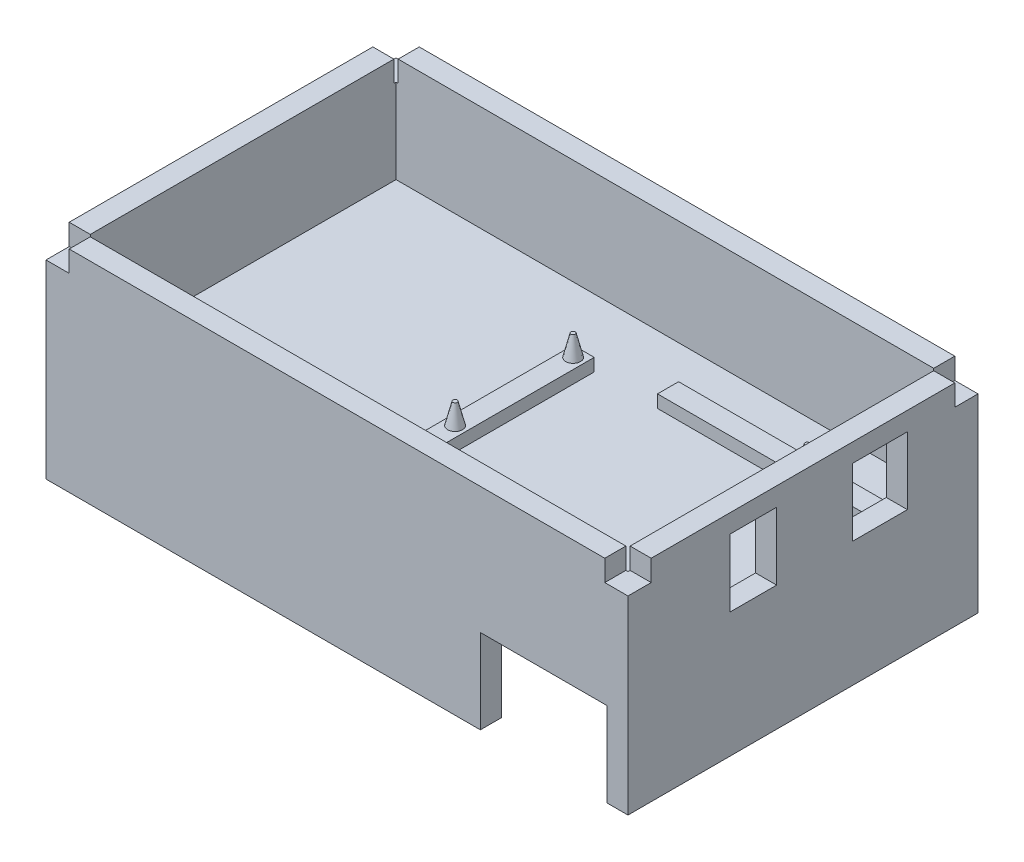
from build123d import *

# Parameters (mm, degrees)
SKETCH1_W                      = 138
SKETCH1_H                      = 83
BOSS_EXTRUDE1_DEPTH            = 5
SKETCH2_W                      = 138
SKETCH2_H                      = 83
SKETCH2_W_2                    = 128
SKETCH2_H_2                    = 73
BOSS_EXTRUDE2_DEPTH            = 20
CUT_EXTRUDE1_REACH             = 108.042
SKETCH3_W                      = 30
SKETCH3_H                      = 20
SKETCH4_W                      = 138
SKETCH4_H                      = 83
SKETCH4_W_2                    = 128
SKETCH4_H_2                    = 73
BOSS_EXTRUDE3_DEPTH            = 25
SKETCH5_W                      = 50
SKETCH5_H                      = 5
SKETCH5_W_2                    = 5
SKETCH5_H_2                    = 35
BOSS_EXTRUDE10_DEPTH           = 3
SKETCH6_R                      = 1.75
BOSS_EXTRUDE11_DEPTH           = 5
BOSS_EXTRUDE11_DRAFT           = 14
BOSS_EXTRUDE11_PROFILE_2_DEPTH = 5
BOSS_EXTRUDE11_PROFILE_2_DRAFT = 14
BOSS_EXTRUDE11_PROFILE_3_DEPTH = 5
BOSS_EXTRUDE11_PROFILE_3_DRAFT = 14
BOSS_EXTRUDE11_PROFILE_4_DEPTH = 5
BOSS_EXTRUDE11_PROFILE_4_DRAFT = 14
CUT_EXTRUDE2_REACH             = 144.518
SKETCH7_W                      = 13
SKETCH7_H                      = 16
CUT_EXTRUDE3_REACH             = 144.518
SKETCH8_W                      = 11
SKETCH8_H                      = 16
SKETCH11_W                     = 5.5
SKETCH11_H                     = 5.5
CUT_EXTRUDE7_DEPTH             = 5


with BuildPart() as part:
    # Sketch1 → Boss-Extrude1 (new body)
    with BuildSketch(Plane(origin=(0, 0, 0), x_dir=(1, 0, 0), z_dir=(0, 1, 0))):
        Rectangle(SKETCH1_W, SKETCH1_H)
    extrude(amount=BOSS_EXTRUDE1_DEPTH)

    # Sketch2 → Boss-Extrude2 (add)
    with BuildSketch(Plane.XZ):
        Rectangle(SKETCH2_W, SKETCH2_H)
        Rectangle(SKETCH2_W_2, SKETCH2_H_2, mode=Mode.SUBTRACT)
    extrude(amount=BOSS_EXTRUDE2_DEPTH)

    # Sketch3 → Cut-Extrude1 (cut, up to next)
    with BuildSketch(Plane(origin=(0, 0, 36.5), x_dir=(-1, 0, 0), z_dir=(0, 0, -1)), mode=Mode.PRIVATE) as cut_extrude1_sk1:
        with Locations((-49, -10)):
            Rectangle(SKETCH3_W, SKETCH3_H)
    cut_extrude1_tool1 = extrude(cut_extrude1_sk1.sketch, amount=-CUT_EXTRUDE1_REACH, mode=Mode.PRIVATE) & part.part
    add(cut_extrude1_tool1.solids().sort_by_distance((49, -10, 36.5))[0], mode=Mode.SUBTRACT)

    # Sketch4 → Boss-Extrude3 (add)
    with BuildSketch(Plane(origin=(0, 5, 0), x_dir=(1, 0, 0), z_dir=(0, 1, 0))):
        Rectangle(SKETCH4_W, SKETCH4_H)
        Rectangle(SKETCH4_W_2, SKETCH4_H_2, mode=Mode.SUBTRACT)
    extrude(amount=BOSS_EXTRUDE3_DEPTH)

    # Sketch5 → Boss-Extrude10 (add)
    with BuildSketch(Plane(origin=(0, 5, 0), x_dir=(1, 0, 0), z_dir=(0, 1, 0))):
        with Locations((39, -26)):
            Rectangle(SKETCH5_W, SKETCH5_H)
        with Locations((39, 23)):
            Rectangle(SKETCH5_W, SKETCH5_H)
        with Locations((-3.5, 3)):
            Rectangle(SKETCH5_W_2, SKETCH5_H_2)
    extrude(amount=BOSS_EXTRUDE10_DEPTH)


with BuildPart() as boss_extrude11_tool:
    # Sketch6 → Boss-Extrude11 (with draft: the straight prism first)
    with BuildSketch(Plane(origin=(0, 8, 0), x_dir=(1, 0, 0), z_dir=(0, 1, 0))):
        with Locations((47, 23)):
            Circle(SKETCH6_R)
    extrude(amount=BOSS_EXTRUDE11_DEPTH)
    # Boss-Extrude11: the draft: its side faces are tilted about the plane it starts from
    boss_extrude11_sides = [boss_extrude11_tool.faces().sort_by_distance(p)[0] for p in [
        (45.25, 10.5, -23),
    ]]
    draft(boss_extrude11_sides, Plane(origin=(0, 8, 0), x_dir=(1, 0, 0), z_dir=(0, 1, 0)), BOSS_EXTRUDE11_DRAFT)


with BuildPart() as part_1:
    add(part.part)

    # Boss-Extrude11: add boss_extrude11_tool
    add(boss_extrude11_tool.part)


with BuildPart() as boss_extrude11_profile_2_tool:
    # Sketch6 → Boss-Extrude11 profile 2 (with draft: the straight prism first)
    with BuildSketch(Plane(origin=(0, 8, 0), x_dir=(1, 0, 0), z_dir=(0, 1, 0))):
        with Locations((47, -26)):
            Circle(SKETCH6_R)
    extrude(amount=BOSS_EXTRUDE11_PROFILE_2_DEPTH)
    # Boss-Extrude11 profile 2: the draft: its side faces are tilted about the plane it starts from
    boss_extrude11_profile_2_sides = [boss_extrude11_profile_2_tool.faces().sort_by_distance(p)[0] for p in [
        (45.25, 10.5, 26),
    ]]
    draft(boss_extrude11_profile_2_sides, Plane(origin=(0, 8, 0), x_dir=(1, 0, 0), z_dir=(0, 1, 0)), BOSS_EXTRUDE11_PROFILE_2_DRAFT)


with BuildPart() as part_2:
    add(part_1.part)

    # Boss-Extrude11 profile 2: add boss_extrude11_profile_2_tool
    add(boss_extrude11_profile_2_tool.part)


with BuildPart() as boss_extrude11_profile_3_tool:
    # Sketch6 → Boss-Extrude11 profile 3 (with draft: the straight prism first)
    with BuildSketch(Plane(origin=(0, 8, 0), x_dir=(1, 0, 0), z_dir=(0, 1, 0))):
        with Locations((-3.5, 18)):
            Circle(SKETCH6_R)
    extrude(amount=BOSS_EXTRUDE11_PROFILE_3_DEPTH)
    # Boss-Extrude11 profile 3: the draft: its side faces are tilted about the plane it starts from
    boss_extrude11_profile_3_sides = [boss_extrude11_profile_3_tool.faces().sort_by_distance(p)[0] for p in [
        (-5.25, 10.5, -18),
    ]]
    draft(boss_extrude11_profile_3_sides, Plane(origin=(0, 8, 0), x_dir=(1, 0, 0), z_dir=(0, 1, 0)), BOSS_EXTRUDE11_PROFILE_3_DRAFT)


with BuildPart() as part_3:
    add(part_2.part)

    # Boss-Extrude11 profile 3: add boss_extrude11_profile_3_tool
    add(boss_extrude11_profile_3_tool.part)


with BuildPart() as boss_extrude11_profile_4_tool:
    # Sketch6 → Boss-Extrude11 profile 4 (with draft: the straight prism first)
    with BuildSketch(Plane(origin=(0, 8, 0), x_dir=(1, 0, 0), z_dir=(0, 1, 0))):
        with Locations((-3.5, -10)):
            Circle(SKETCH6_R)
    extrude(amount=BOSS_EXTRUDE11_PROFILE_4_DEPTH)
    # Boss-Extrude11 profile 4: the draft: its side faces are tilted about the plane it starts from
    boss_extrude11_profile_4_sides = [boss_extrude11_profile_4_tool.faces().sort_by_distance(p)[0] for p in [
        (-5.25, 10.5, 10),
    ]]
    draft(boss_extrude11_profile_4_sides, Plane(origin=(0, 8, 0), x_dir=(1, 0, 0), z_dir=(0, 1, 0)), BOSS_EXTRUDE11_PROFILE_4_DRAFT)


with BuildPart() as part_4:
    add(part_3.part)

    # Boss-Extrude11 profile 4: add boss_extrude11_profile_4_tool
    add(boss_extrude11_profile_4_tool.part)

    # Sketch7 → Cut-Extrude2 (cut, up to next)
    with BuildSketch(Plane.ZY.offset(-64), mode=Mode.PRIVATE) as cut_extrude2_sk1:
        with Locations((-18.25, 17.6)):
            Rectangle(SKETCH7_W, SKETCH7_H)
    cut_extrude2_tool1 = extrude(cut_extrude2_sk1.sketch, amount=-CUT_EXTRUDE2_REACH, mode=Mode.PRIVATE) & part_4.part
    add(cut_extrude2_tool1.solids().sort_by_distance((64, 17.6, -18.25))[0], mode=Mode.SUBTRACT)

    # Sketch8 → Cut-Extrude3 (cut, up to next)
    with BuildSketch(Plane.ZY.offset(-64), mode=Mode.PRIVATE) as cut_extrude3_sk1:
        with Locations((11.75, 17.6)):
            Rectangle(SKETCH8_W, SKETCH8_H)
    cut_extrude3_tool1 = extrude(cut_extrude3_sk1.sketch, amount=-CUT_EXTRUDE3_REACH, mode=Mode.PRIVATE) & part_4.part
    add(cut_extrude3_tool1.solids().sort_by_distance((64, 17.6, 11.75))[0], mode=Mode.SUBTRACT)

    # Sketch11 → Cut-Extrude7 (cut)
    with BuildSketch(Plane(origin=(0, 30, 0), x_dir=(1, 0, 0), z_dir=(0, 1, 0))):
        with Locations((-66.25, 38.75)):
            Rectangle(SKETCH11_W, SKETCH11_H)
        with Locations((-66.25, -38.75)):
            Rectangle(SKETCH11_W, SKETCH11_H)
        with Locations((66.25, -38.75)):
            Rectangle(SKETCH11_W, SKETCH11_H)
        with Locations((66.25, 38.75)):
            Rectangle(SKETCH11_W, SKETCH11_H)
    extrude(amount=-CUT_EXTRUDE7_DEPTH, mode=Mode.SUBTRACT)


solid = part_4.part
